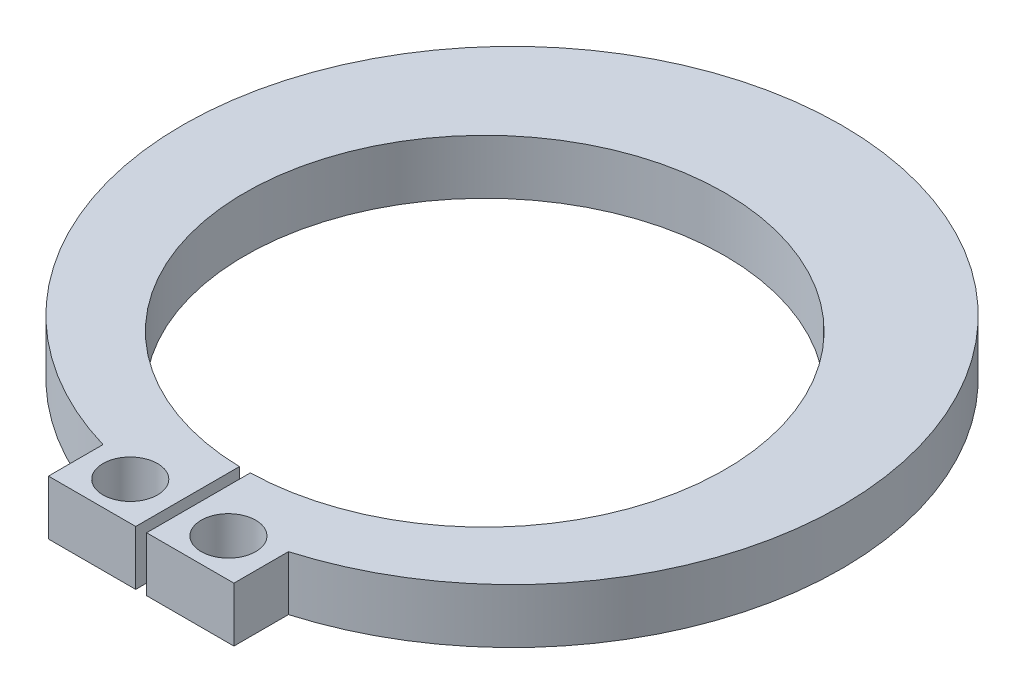
from build123d import *

# Parameters (mm, degrees)
SKETCH1_R           = 0.5
BOSS_EXTRUDE1_DEPTH = 1


with BuildPart() as part:
    # Sketch1 → Boss-Extrude1 (new body)
    with BuildSketch(Plane(origin=(0, 0, 0), x_dir=(1, 0, 0), z_dir=(0, 1, 0))):
        with BuildLine():
            Line((-1.7, -6.8), (-0.1, -6.8))
            Line((-0.1, -6.8), (-0.1, -4.89886349))
            ThreePointArc((-0.1, -4.89886349), (0, 3.9), (0.1, -4.89886349))
            Line((0.1, -4.89886349), (0.1, -6.8))
            Line((0.1, -6.8), (1.7, -6.8))
            Line((1.7, -6.8), (1.7, -5.8))
            ThreePointArc((1.7, -5.8), (0, 6.044005295), (-1.7, -5.8))
            Line((-1.7, -5.8), (-1.7, -6.8))
        make_face()
        with Locations(Location((-0.9, -6.1, 0), (0, 0, 270))):
            Circle(SKETCH1_R, mode=Mode.SUBTRACT)
        with Locations(Location((0.9, -6.1, 0), (0, 0, 90))):
            Circle(SKETCH1_R, mode=Mode.SUBTRACT)
    extrude(amount=BOSS_EXTRUDE1_DEPTH)


solid = part.part
